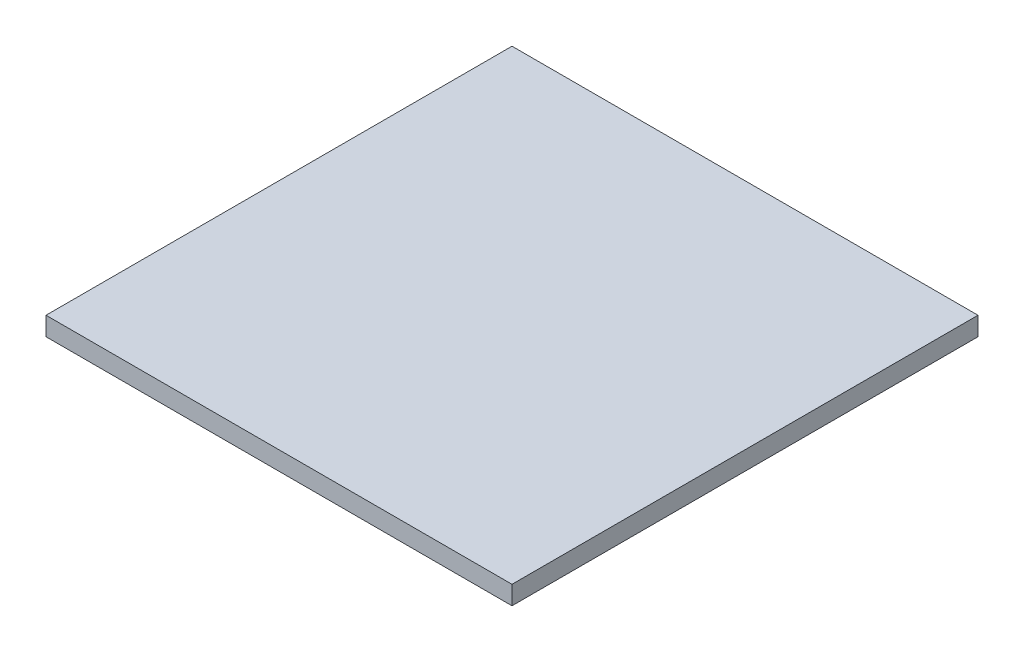
from build123d import *

# Parameters (mm, degrees)
SKETCH1_W           = 250
SKETCH1_H           = 250
BOSS_EXTRUDE1_DEPTH = 10


with BuildPart() as part:
    # Sketch1 → Boss-Extrude1 (new body)
    with BuildSketch(Plane(origin=(0, 0, 0), x_dir=(1, 0, 0), z_dir=(0, 1, 0))):
        with Locations((125, 125)):
            Rectangle(SKETCH1_W, SKETCH1_H)
    extrude(amount=BOSS_EXTRUDE1_DEPTH)


solid = part.part
